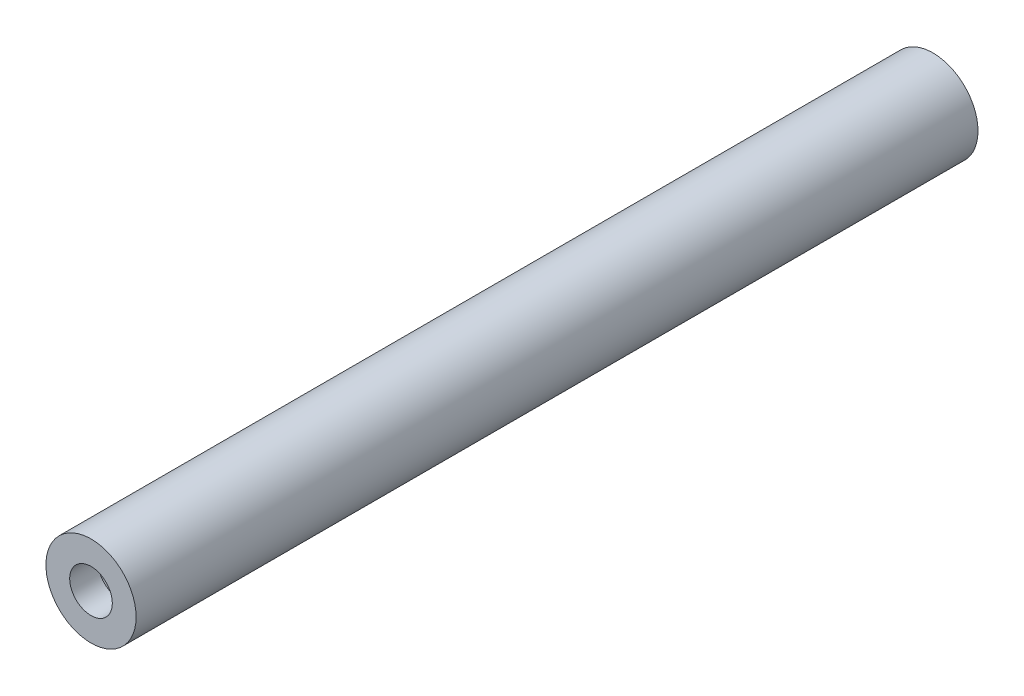
from build123d import *

# Parameters (mm, degrees)
SKETCH1_R           = 4.7625
BOSS_EXTRUDE1_DEPTH = 88.9
SKETCH2_R           = 2.25
CUT_EXTRUDE1_DEPTH  = 3


with BuildPart() as part:
    # Sketch1 → Boss-Extrude1 (new body)
    with BuildSketch(Plane.XY):
        Circle(SKETCH1_R)
    extrude(amount=-BOSS_EXTRUDE1_DEPTH)

    # Sketch2 → Cut-Extrude1 (cut)
    with BuildSketch(Plane.XY):
        Circle(SKETCH2_R)
    extrude(amount=-CUT_EXTRUDE1_DEPTH, mode=Mode.SUBTRACT)


solid = part.part
